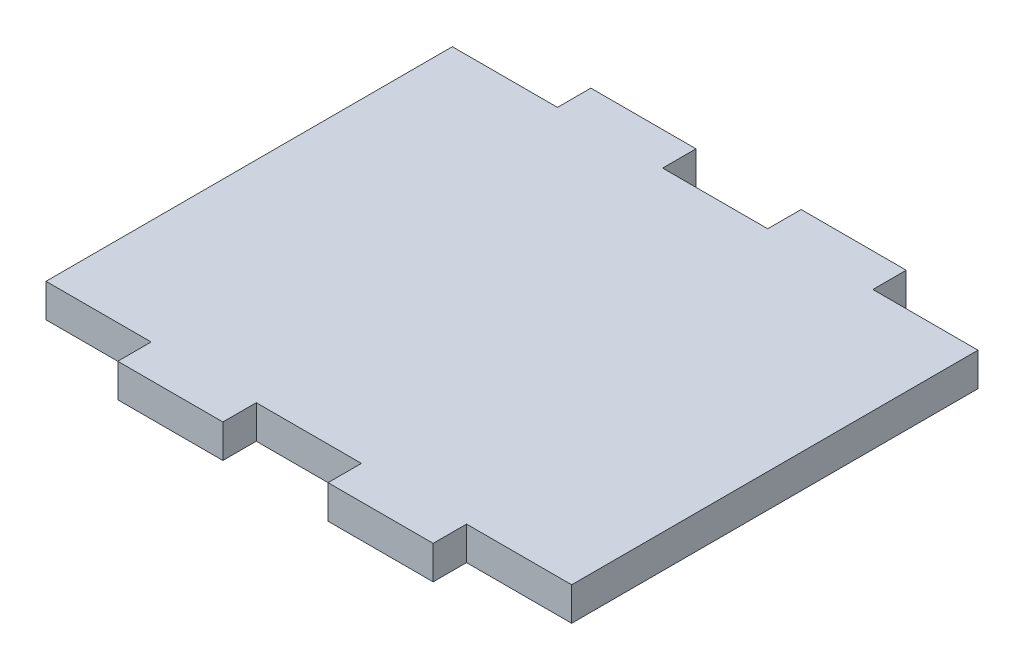
from build123d import *

# Parameters (mm, degrees)
BOSS_EXTRUDE1_DEPTH = 3.175


with BuildPart() as part:
    # Sketch1 → Boss-Extrude1 (new body)
    with BuildSketch(Plane(origin=(0, 0, 0), x_dir=(1, 0, 0), z_dir=(0, 1, 0))):
        Polygon((0, 3.175), (0, 41.825), (10, 41.825), (10, 45), (20, 45), (20, 41.825), (30, 41.825), (30, 45), (40, 45), (40, 41.825), (50, 41.825), (50, 3.175), (40, 3.175), (40, 0), (30, 0), (30, 3.175), (20, 3.175), (20, 0), (10, 0), (10, 3.175), align=None)
    extrude(amount=BOSS_EXTRUDE1_DEPTH)


solid = part.part
